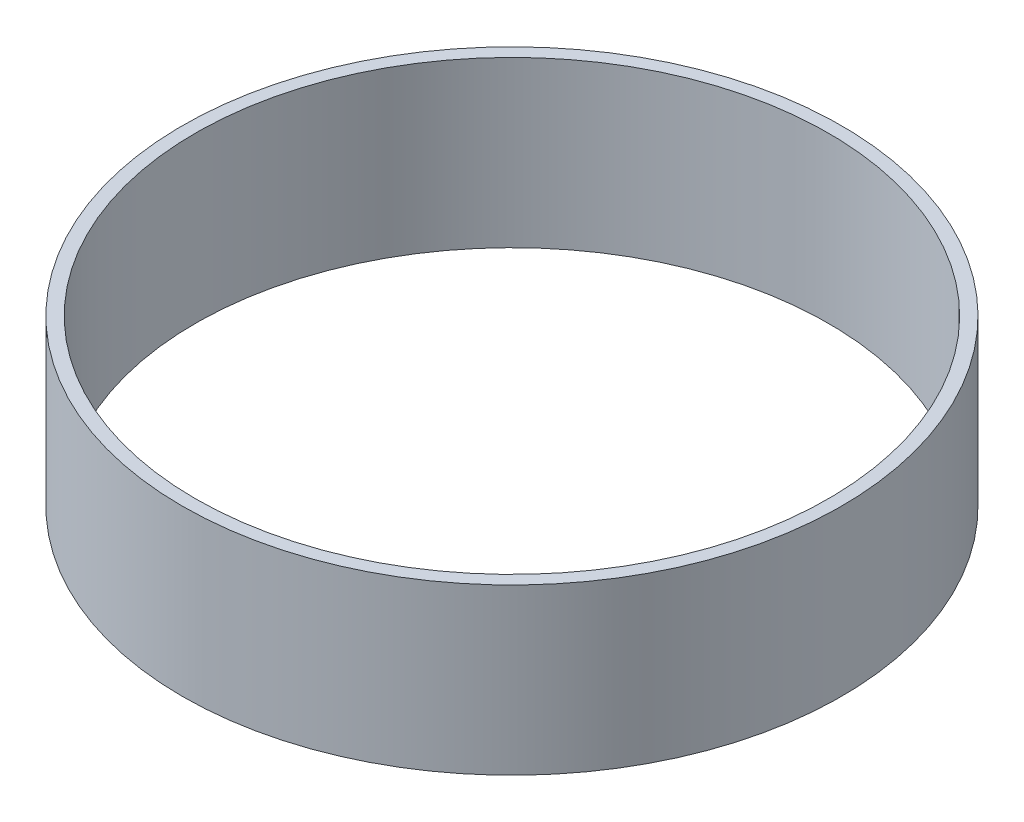
from build123d import *

# Parameters (mm, degrees)
SKETCH1_R           = 25.4
SKETCH1_R_2         = 24.4
BOSS_EXTRUDE1_DEPTH = 12.7


with BuildPart() as part:
    # Sketch1 → Boss-Extrude1 (new body)
    with BuildSketch(Plane(origin=(0, 0, 0), x_dir=(1, 0, 0), z_dir=(0, 1, 0))):
        with Locations(Location((0, 0, 0), (0, 0, 270))):
            Circle(SKETCH1_R)
        with Locations(Location((0, 0, 0), (0, 0, 270))):
            Circle(SKETCH1_R_2, mode=Mode.SUBTRACT)
    extrude(amount=BOSS_EXTRUDE1_DEPTH)


solid = part.part
